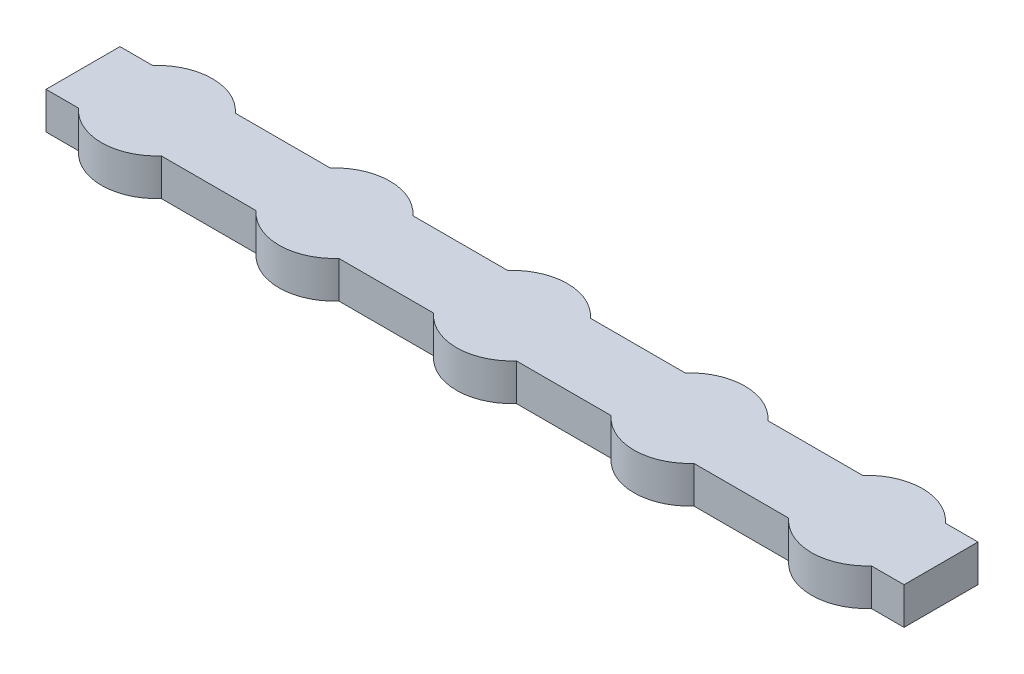
from build123d import *

# Parameters (mm, degrees)
ESQUISSE1_W        = 116
ESQUISSE1_H        = 5
BOSS_EXTRU_1_DEPTH = 10
ESQUISSE3_R        = 7.5
BOSS_EXTRU_3_DEPTH = 5


with BuildPart() as part:
    # Esquisse1 → Boss.-Extru.1 (new body)
    with BuildSketch(Plane.XY):
        with Locations((0, 2.5)):
            Rectangle(ESQUISSE1_W, ESQUISSE1_H)
    extrude(amount=BOSS_EXTRU_1_DEPTH)

    # Esquisse3 → Boss.-Extru.3 (add)
    with BuildSketch(Plane(origin=(0, 0, 0), x_dir=(1, 0, 0), z_dir=(0, 1, 0))):
        with Locations((-48, -5)):
            Circle(ESQUISSE3_R)
        with Locations((-24, -5)):
            Circle(ESQUISSE3_R)
        with Locations((0, -5)):
            Circle(ESQUISSE3_R)
        with Locations((24, -5)):
            Circle(ESQUISSE3_R)
        with Locations((48, -5)):
            Circle(ESQUISSE3_R)
    extrude(amount=BOSS_EXTRU_3_DEPTH)


solid = part.part
